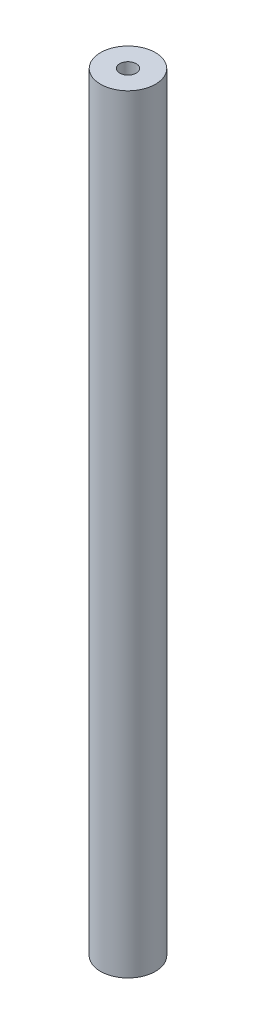
from build123d import *

# Parameters (mm, degrees)
SKETCH1_R           = 5
SKETCH1_R_2         = 1.5
BOSS_EXTRUDE1_DEPTH = 140


with BuildPart() as part:
    # Sketch1 → Boss-Extrude1 (new body)
    with BuildSketch(Plane(origin=(0, 0, 0), x_dir=(1, 0, 0), z_dir=(0, 1, 0))):
        with Locations(Location((0, 0, 0), (0, 0, 270))):
            Circle(SKETCH1_R)
        with Locations(Location((0, 0, 0), (0, 0, 270))):
            Circle(SKETCH1_R_2, mode=Mode.SUBTRACT)
    extrude(amount=BOSS_EXTRUDE1_DEPTH)


solid = part.part
